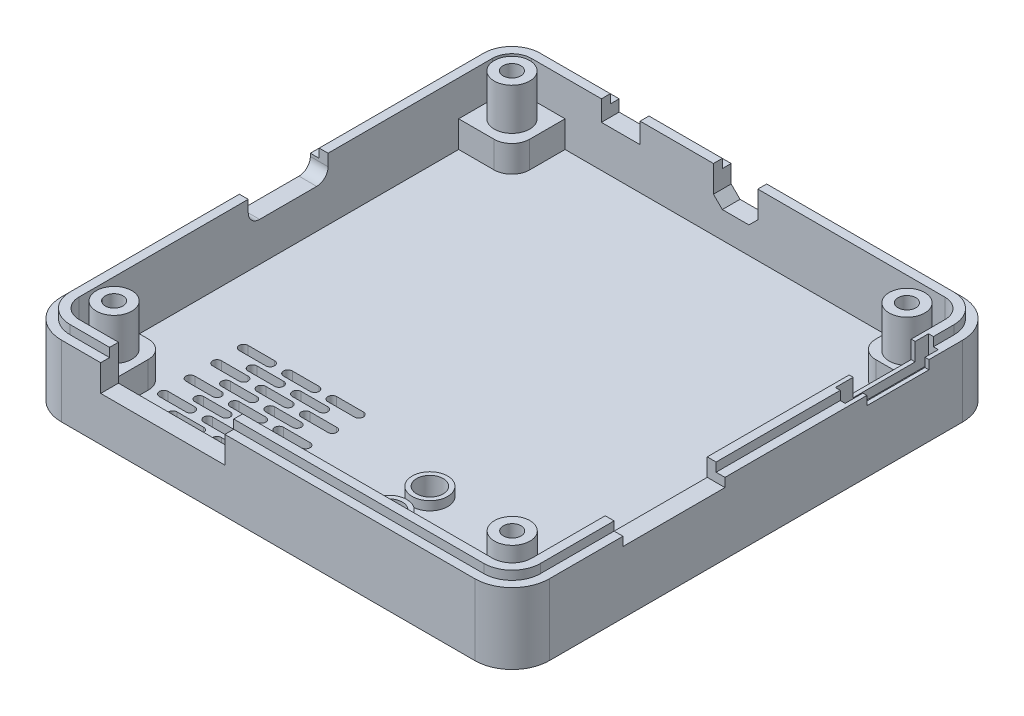
from build123d import *

# Parameters (mm, degrees)
BOSS_EXTRUDE1_DEPTH = 8
BOSS_EXTRUDE2_DEPTH = 9
BOSS_EXTRUDE3_DEPTH = 2
BOSS_EXTRUDE4_DEPTH = 5
SKETCH3_W           = 4.36
SKETCH3_H           = 2.3
CUT_EXTRUDE1_DEPTH  = 1
SKETCH4_R           = 2
SKETCH4_R_2         = 1
BOSS_EXTRUDE5_DEPTH = 4.7
SKETCH5_W           = 1.1
SKETCH5_H           = 10.5
CUT_EXTRUDE2_DEPTH  = 3
SKETCH6_W           = 11.5
SKETCH6_H           = 2
SKETCH6_W_2         = 7
CUT_EXTRUDE3_DEPTH  = 3
SKETCH7_W           = 14
SKETCH7_H           = 4
CUT_EXTRUDE4_DEPTH  = 2
CUT_EXTRUDE5_DEPTH  = 2
SKETCH10_R          = 1.5
CUT_EXTRUDE6_DEPTH  = 2
CUT_EXTRUDE8_DEPTH  = 2
BOSS_EXTRUDE6_START = 1
SKETCH10_3_R        = 2
SKETCH10_3_R_2      = 1.5
BOSS_EXTRUDE6_DEPTH = 1


with BuildPart() as part:
    # Sketch1 → Boss-Extrude1 (new body)
    with BuildSketch(Plane(origin=(0, 0, 0), x_dir=(1, 0, 0), z_dir=(0, 1, 0))):
        with BuildLine():
            Line((23.315, 27.5), (-23.315, 27.5))
            ThreePointArc((-23.315, 27.5), (-26.284848481, 26.269848481), (-27.515, 23.3))
            Line((-27.515, 23.3), (-27.515, -23.3))
            ThreePointArc((-27.515, -23.3), (-26.284848481, -26.269848481), (-23.315, -27.5))
            Line((-23.315, -27.5), (23.315, -27.5))
            ThreePointArc((23.315, -27.5), (26.284848481, -26.269848481), (27.515, -23.3))
            Line((27.515, -23.3), (27.515, 23.3))
            ThreePointArc((27.515, 23.3), (26.284848481, 26.269848481), (23.315, 27.5))
        make_face()
        with BuildLine():
            ThreePointArc((-26.515, 23.3), (-25.5777417, 25.5627417), (-23.315, 26.5))
            Line((-23.315, 26.5), (23.315, 26.5))
            ThreePointArc((23.315, 26.5), (25.5777417, 25.5627417), (26.515, 23.3))
            Line((26.515, 23.3), (26.515, -23.3))
            ThreePointArc((26.515, -23.3), (25.5777417, -25.5627417), (23.315, -26.5))
            Line((23.315, -26.5), (-23.315, -26.5))
            ThreePointArc((-23.315, -26.5), (-25.5777417, -25.5627417), (-26.515, -23.3))
            Line((-26.515, -23.3), (-26.515, 23.3))
        make_face(mode=Mode.SUBTRACT)
    extrude(amount=BOSS_EXTRUDE1_DEPTH)

    # Sketch1<3> → Boss-Extrude2 (add)
    with BuildSketch(Plane(origin=(0, 0, 0), x_dir=(1, 0, 0), z_dir=(0, 1, 0))):
        with BuildLine():
            Line((23.315, 26.5), (-23.315, 26.5))
            ThreePointArc((-23.315, 26.5), (-25.5777417, 25.5627417), (-26.515, 23.3))
            Line((-26.515, 23.3), (-26.515, -23.3))
            ThreePointArc((-26.515, -23.3), (-25.5777417, -25.5627417), (-23.315, -26.5))
            Line((-23.315, -26.5), (23.315, -26.5))
            ThreePointArc((23.315, -26.5), (25.5777417, -25.5627417), (26.515, -23.3))
            Line((26.515, -23.3), (26.515, 23.3))
            ThreePointArc((26.515, 23.3), (25.5777417, 25.5627417), (23.315, 26.5))
        make_face()
        with BuildLine():
            Line((-23.315, 25.5), (-19.515, 25.5))
            Line((-19.515, 25.5), (19.515, 25.5))
            Line((19.515, 25.5), (23.315, 25.5))
            ThreePointArc((23.315, 25.5), (24.870634919, 24.855634919), (25.515, 23.3))
            Line((25.515, 23.3), (25.515, 19.5))
            Line((25.515, 19.5), (25.515, -19.5))
            Line((25.515, -19.5), (25.515, -23.3))
            ThreePointArc((25.515, -23.3), (24.870634919, -24.855634919), (23.315, -25.5))
            Line((23.315, -25.5), (19.515, -25.5))
            Line((19.515, -25.5), (-19.515, -25.5))
            Line((-19.515, -25.5), (-23.315, -25.5))
            ThreePointArc((-23.315, -25.5), (-24.870634919, -24.855634919), (-25.515, -23.3))
            Line((-25.515, -23.3), (-25.515, -19.5))
            Line((-25.515, -19.5), (-25.515, 19.5))
            Line((-25.515, 19.5), (-25.515, 23.3))
            ThreePointArc((-25.515, 23.3), (-24.870634919, 24.855634919), (-23.315, 25.5))
        make_face(mode=Mode.SUBTRACT)
    extrude(amount=BOSS_EXTRUDE2_DEPTH)

    # Sketch1<4> → Boss-Extrude3 (add)
    with BuildSketch(Plane(origin=(0, 0, 0), x_dir=(1, 0, 0), z_dir=(0, 1, 0))):
        with BuildLine():
            Line((19.515, 25.5), (-19.515, 25.5))
            Line((-19.515, 25.5), (-19.515, 21.5))
            ThreePointArc((-19.515, 21.5), (-20.100786438, 20.085786438), (-21.515, 19.5))
            Line((-21.515, 19.5), (-25.515, 19.5))
            Line((-25.515, 19.5), (-25.515, -19.5))
            Line((-25.515, -19.5), (-21.515, -19.5))
            ThreePointArc((-21.515, -19.5), (-20.100786438, -20.085786438), (-19.515, -21.5))
            Line((-19.515, -21.5), (-19.515, -25.5))
            Line((-19.515, -25.5), (19.515, -25.5))
            Line((19.515, -25.5), (19.515, -21.5))
            ThreePointArc((19.515, -21.5), (20.100786438, -20.085786438), (21.515, -19.5))
            Line((21.515, -19.5), (25.515, -19.5))
            Line((25.515, -19.5), (25.515, 19.5))
            Line((25.515, 19.5), (21.515, 19.5))
            ThreePointArc((21.515, 19.5), (20.100786438, 20.085786438), (19.515, 21.5))
            Line((19.515, 21.5), (19.515, 25.5))
        make_face()
    extrude(amount=BOSS_EXTRUDE3_DEPTH)

    # Sketch1<5> → Boss-Extrude4 (add)
    with BuildSketch(Plane(origin=(0, 0, 0), x_dir=(1, 0, 0), z_dir=(0, 1, 0))):
        with BuildLine():
            Line((-19.515, 21.5), (-19.515, 25.5))
            Line((-19.515, 25.5), (-23.315, 25.5))
            ThreePointArc((-23.315, 25.5), (-24.870634919, 24.855634919), (-25.515, 23.3))
            Line((-25.515, 23.3), (-25.515, 19.5))
            Line((-25.515, 19.5), (-21.515, 19.5))
            ThreePointArc((-21.515, 19.5), (-20.100786438, 20.085786438), (-19.515, 21.5))
        make_face()
        with BuildLine():
            Line((23.315, 25.5), (19.515, 25.5))
            Line((19.515, 25.5), (19.515, 21.5))
            ThreePointArc((19.515, 21.5), (20.100786438, 20.085786438), (21.515, 19.5))
            Line((21.515, 19.5), (25.515, 19.5))
            Line((25.515, 19.5), (25.515, 23.3))
            ThreePointArc((25.515, 23.3), (24.870634919, 24.855634919), (23.315, 25.5))
        make_face()
        with BuildLine():
            Line((-21.515, -19.5), (-25.515, -19.5))
            Line((-25.515, -19.5), (-25.515, -23.3))
            ThreePointArc((-25.515, -23.3), (-24.870634919, -24.855634919), (-23.315, -25.5))
            Line((-23.315, -25.5), (-19.515, -25.5))
            Line((-19.515, -25.5), (-19.515, -21.5))
            ThreePointArc((-19.515, -21.5), (-20.100786438, -20.085786438), (-21.515, -19.5))
        make_face()
        with BuildLine():
            Line((25.515, -23.3), (25.515, -19.5))
            Line((25.515, -19.5), (21.515, -19.5))
            ThreePointArc((21.515, -19.5), (20.100786438, -20.085786438), (19.515, -21.5))
            Line((19.515, -21.5), (19.515, -25.5))
            Line((19.515, -25.5), (23.315, -25.5))
            ThreePointArc((23.315, -25.5), (24.870634919, -24.855634919), (25.515, -23.3))
        make_face()
    extrude(amount=BOSS_EXTRUDE4_DEPTH)

    # Sketch3 → Cut-Extrude1 (cut, symmetric)
    with BuildSketch(Plane(origin=(0, 0, -26.5), x_dir=(-1, 0, 0), z_dir=(0, 0, -1))):
        Polygon((1.785, 5), (-1.215, 5), (-2.215, 6), (-2.215, 9), (2.785, 9), (2.785, 6), align=None)
        with Locations((13.235, 7.85)):
            Rectangle(SKETCH3_W, SKETCH3_H)
    extrude(amount=CUT_EXTRUDE1_DEPTH, both=True, mode=Mode.SUBTRACT)

    # Sketch4 → Boss-Extrude5 (add)
    # profile 1 of 4: a face of its own
    with BuildSketch(Plane(origin=(0, 5, 0), x_dir=(1, 0, 0), z_dir=(0, 1, 0))):
        with Locations((-22.495, 22.49)):
            Circle(SKETCH4_R)
        with Locations((-22.495, 22.49)):
            Circle(SKETCH4_R_2, mode=Mode.SUBTRACT)
    # profile 2 of 4: a face of its own
    with BuildSketch(Plane(origin=(0, 5, 0), x_dir=(1, 0, 0), z_dir=(0, 1, 0))):
        with Locations((22.425, 22.11)):
            Circle(SKETCH4_R)
        with Locations((22.425, 22.11)):
            Circle(SKETCH4_R_2, mode=Mode.SUBTRACT)
    # profile 3 of 4: a face of its own
    with BuildSketch(Plane(origin=(0, 5, 0), x_dir=(1, 0, 0), z_dir=(0, 1, 0))):
        with Locations((22.445, -22.42)):
            Circle(SKETCH4_R)
        with Locations((22.445, -22.42)):
            Circle(SKETCH4_R_2, mode=Mode.SUBTRACT)
    # profile 4 of 4: a face of its own
    with BuildSketch(Plane(origin=(0, 5, 0), x_dir=(1, 0, 0), z_dir=(0, 1, 0))):
        with Locations((-22.455, -22.41)):
            Circle(SKETCH4_R)
        with Locations((-22.455, -22.41)):
            Circle(SKETCH4_R_2, mode=Mode.SUBTRACT)
    extrude(amount=BOSS_EXTRUDE5_DEPTH)

    # Sketch5 → Cut-Extrude2 (cut)
    with BuildSketch(Plane(origin=(0, 9, 0), x_dir=(1, 0, 0), z_dir=(0, 1, 0))):
        with Locations((26.515, 15.75)):
            Rectangle(SKETCH5_W, SKETCH5_H)
    extrude(amount=-CUT_EXTRUDE2_DEPTH, mode=Mode.SUBTRACT)

    # Sketch6 → Cut-Extrude3 (cut)
    with BuildSketch(Plane(origin=(27.515, 0, 0), x_dir=(0, 0, -1), z_dir=(1, 0, 0))):
        with Locations((-9.25, 8)):
            Rectangle(SKETCH6_W, SKETCH6_H)
        with Locations((16, 8)):
            Rectangle(SKETCH6_W_2, SKETCH6_H)
    extrude(amount=-CUT_EXTRUDE3_DEPTH, mode=Mode.SUBTRACT)

    # Sketch7 → Cut-Extrude4 (cut)
    with BuildSketch(Plane.XY.offset(27.5)):
        with Locations((-11.875, 7)):
            Rectangle(SKETCH7_W, SKETCH7_H)
    extrude(amount=-CUT_EXTRUDE4_DEPTH, mode=Mode.SUBTRACT)

    # Sketch8 → Cut-Extrude5 (cut)
    with BuildSketch(Plane.ZY.offset(27.515)):
        with BuildLine():
            Line((-4.775, 9), (4.225, 9))
            Line((4.225, 9), (4.225, 7.68))
            ThreePointArc((4.225, 7.68), (3.85009668, 6.77490332), (2.945, 6.4))
            Line((2.945, 6.4), (-3.495, 6.4))
            ThreePointArc((-3.495, 6.4), (-4.40009668, 6.77490332), (-4.775, 7.68))
            Line((-4.775, 7.68), (-4.775, 9))
        make_face()
    extrude(amount=-CUT_EXTRUDE5_DEPTH, mode=Mode.SUBTRACT)

    # Sketch10 → Cut-Extrude6 (cut)
    with BuildSketch(Plane(origin=(0, 2, 0), x_dir=(1, 0, 0), z_dir=(0, 1, 0))):
        with Locations((6.745, -16)):
            Circle(SKETCH10_R)
        with Locations((6.745, -20.6)):
            Circle(SKETCH10_R)
    extrude(amount=-CUT_EXTRUDE6_DEPTH, mode=Mode.SUBTRACT)

    # Sketch11 → Cut-Extrude8 (cut)
    with BuildSketch(Plane.XZ):
        with BuildLine():
            Line((-13.265, 18.5), (-10.265, 18.5))
            ThreePointArc((-10.265, 18.5), (-9.765, 18), (-10.265, 17.5))
            Line((-10.265, 17.5), (-13.265, 17.5))
            ThreePointArc((-13.265, 17.5), (-13.765, 18), (-13.265, 18.5))
        make_face()
        with BuildLine():
            Line((-8.265, 18.5), (-5.265, 18.5))
            ThreePointArc((-5.265, 18.5), (-4.765, 18), (-5.265, 17.5))
            Line((-5.265, 17.5), (-8.265, 17.5))
            ThreePointArc((-8.265, 17.5), (-8.765, 18), (-8.265, 18.5))
        make_face()
        with BuildLine():
            Line((-18.265, 18.5), (-15.265, 18.5))
            ThreePointArc((-15.265, 18.5), (-14.765, 18), (-15.265, 17.5))
            Line((-15.265, 17.5), (-18.265, 17.5))
            ThreePointArc((-18.265, 17.5), (-18.765, 18), (-18.265, 18.5))
        make_face()
        with BuildLine():
            Line((-7.765, 19), (-10.765, 19))
            ThreePointArc((-10.765, 19), (-11.265, 19.5), (-10.765, 20))
            Line((-10.765, 20), (-7.765, 20))
            ThreePointArc((-7.765, 20), (-7.265, 19.5), (-7.765, 19))
        make_face()
        with BuildLine():
            Line((-12.765, 19), (-15.765, 19))
            ThreePointArc((-15.765, 19), (-16.265, 19.5), (-15.765, 20))
            Line((-15.765, 20), (-12.765, 20))
            ThreePointArc((-12.765, 20), (-12.265, 19.5), (-12.765, 19))
        make_face()
        with BuildLine():
            Line((-18.265, 21.5), (-15.265, 21.5))
            ThreePointArc((-15.265, 21.5), (-14.765, 21), (-15.265, 20.5))
            Line((-15.265, 20.5), (-18.265, 20.5))
            ThreePointArc((-18.265, 20.5), (-18.765, 21), (-18.265, 21.5))
        make_face()
        with BuildLine():
            Line((-13.265, 21.5), (-10.265, 21.5))
            ThreePointArc((-10.265, 21.5), (-9.765, 21), (-10.265, 20.5))
            Line((-10.265, 20.5), (-13.265, 20.5))
            ThreePointArc((-13.265, 20.5), (-13.765, 21), (-13.265, 21.5))
        make_face()
        with BuildLine():
            Line((-8.265, 21.5), (-5.265, 21.5))
            ThreePointArc((-5.265, 21.5), (-4.765, 21), (-5.265, 20.5))
            Line((-5.265, 20.5), (-8.265, 20.5))
            ThreePointArc((-8.265, 20.5), (-8.765, 21), (-8.265, 21.5))
        make_face()
        with BuildLine():
            Line((-7.765, 16), (-10.765, 16))
            ThreePointArc((-10.765, 16), (-11.265, 16.5), (-10.765, 17))
            Line((-10.765, 17), (-7.765, 17))
            ThreePointArc((-7.765, 17), (-7.265, 16.5), (-7.765, 16))
        make_face()
        with BuildLine():
            Line((-12.765, 16), (-15.765, 16))
            ThreePointArc((-15.765, 16), (-16.265, 16.5), (-15.765, 17))
            Line((-15.765, 17), (-12.765, 17))
            ThreePointArc((-12.765, 17), (-12.265, 16.5), (-12.765, 16))
        make_face()
        with BuildLine():
            Line((-7.765, 22), (-10.765, 22))
            ThreePointArc((-10.765, 22), (-11.265, 22.5), (-10.765, 23))
            Line((-10.765, 23), (-7.765, 23))
            ThreePointArc((-7.765, 23), (-7.265, 22.5), (-7.765, 22))
        make_face()
        with BuildLine():
            Line((-12.765, 22), (-15.765, 22))
            ThreePointArc((-15.765, 22), (-16.265, 22.5), (-15.765, 23))
            Line((-15.765, 23), (-12.765, 23))
            ThreePointArc((-12.765, 23), (-12.265, 22.5), (-12.765, 22))
        make_face()
        with BuildLine():
            Line((-13.265, 24.5), (-10.265, 24.5))
            ThreePointArc((-10.265, 24.5), (-9.765, 24), (-10.265, 23.5))
            Line((-10.265, 23.5), (-13.265, 23.5))
            ThreePointArc((-13.265, 23.5), (-13.765, 24), (-13.265, 24.5))
        make_face()
        with BuildLine():
            Line((-8.265, 24.5), (-5.265, 24.5))
            ThreePointArc((-5.265, 24.5), (-4.765, 24), (-5.265, 23.5))
            Line((-5.265, 23.5), (-8.265, 23.5))
            ThreePointArc((-8.265, 23.5), (-8.765, 24), (-8.265, 24.5))
        make_face()
        with BuildLine():
            Line((-18.265, 24.5), (-15.265, 24.5))
            ThreePointArc((-15.265, 24.5), (-14.765, 24), (-15.265, 23.5))
            Line((-15.265, 23.5), (-18.265, 23.5))
            ThreePointArc((-18.265, 23.5), (-18.765, 24), (-18.265, 24.5))
        make_face()
        with BuildLine():
            Line((-18.265, 15.5), (-15.265, 15.5))
            ThreePointArc((-15.265, 15.5), (-14.765, 15), (-15.265, 14.5))
            Line((-15.265, 14.5), (-18.265, 14.5))
            ThreePointArc((-18.265, 14.5), (-18.765, 15), (-18.265, 15.5))
        make_face()
        with BuildLine():
            Line((-13.265, 15.5), (-10.265, 15.5))
            ThreePointArc((-10.265, 15.5), (-9.765, 15), (-10.265, 14.5))
            Line((-10.265, 14.5), (-13.265, 14.5))
            ThreePointArc((-13.265, 14.5), (-13.765, 15), (-13.265, 15.5))
        make_face()
        with BuildLine():
            Line((-8.265, 15.5), (-5.265, 15.5))
            ThreePointArc((-5.265, 15.5), (-4.765, 15), (-5.265, 14.5))
            Line((-5.265, 14.5), (-8.265, 14.5))
            ThreePointArc((-8.265, 14.5), (-8.765, 15), (-8.265, 15.5))
        make_face()
        with BuildLine():
            Line((-7.765, 13), (-10.765, 13))
            ThreePointArc((-10.765, 13), (-11.265, 13.5), (-10.765, 14))
            Line((-10.765, 14), (-7.765, 14))
            ThreePointArc((-7.765, 14), (-7.265, 13.5), (-7.765, 13))
        make_face()
        with BuildLine():
            Line((-12.765, 13), (-15.765, 13))
            ThreePointArc((-15.765, 13), (-16.265, 13.5), (-15.765, 14))
            Line((-15.765, 14), (-12.765, 14))
            ThreePointArc((-12.765, 14), (-12.265, 13.5), (-12.765, 13))
        make_face()
        with BuildLine():
            Line((-13.265, 12.5), (-10.265, 12.5))
            ThreePointArc((-10.265, 12.5), (-9.765, 12), (-10.265, 11.5))
            Line((-10.265, 11.5), (-13.265, 11.5))
            ThreePointArc((-13.265, 11.5), (-13.765, 12), (-13.265, 12.5))
        make_face()
        with BuildLine():
            Line((-8.265, 12.5), (-5.265, 12.5))
            ThreePointArc((-5.265, 12.5), (-4.765, 12), (-5.265, 11.5))
            Line((-5.265, 11.5), (-8.265, 11.5))
            ThreePointArc((-8.265, 11.5), (-8.765, 12), (-8.265, 12.5))
        make_face()
        with BuildLine():
            Line((-18.265, 12.5), (-15.265, 12.5))
            ThreePointArc((-15.265, 12.5), (-14.765, 12), (-15.265, 11.5))
            Line((-15.265, 11.5), (-18.265, 11.5))
            ThreePointArc((-18.265, 11.5), (-18.765, 12), (-18.265, 12.5))
        make_face()
    extrude(amount=-CUT_EXTRUDE8_DEPTH, mode=Mode.SUBTRACT)

    # Sketch10<3> → Boss-Extrude6 (add)
    # profile 1 of 2: a face of its own
    with BuildSketch(Plane(origin=(0, 2, 0), x_dir=(1, 0, 0), z_dir=(0, 1, 0)).offset(BOSS_EXTRUDE6_START)):
        with Locations((6.745, -16)):
            Circle(SKETCH10_3_R)
        with Locations((6.745, -16)):
            Circle(SKETCH10_3_R_2, mode=Mode.SUBTRACT)
    # profile 2 of 2: a face of its own
    with BuildSketch(Plane(origin=(0, 2, 0), x_dir=(1, 0, 0), z_dir=(0, 1, 0)).offset(BOSS_EXTRUDE6_START)):
        with Locations((6.745, -20.6)):
            Circle(SKETCH10_3_R)
        with Locations((6.745, -20.6)):
            Circle(SKETCH10_3_R_2, mode=Mode.SUBTRACT)
    extrude(amount=-BOSS_EXTRUDE6_DEPTH)


solid = part.part
